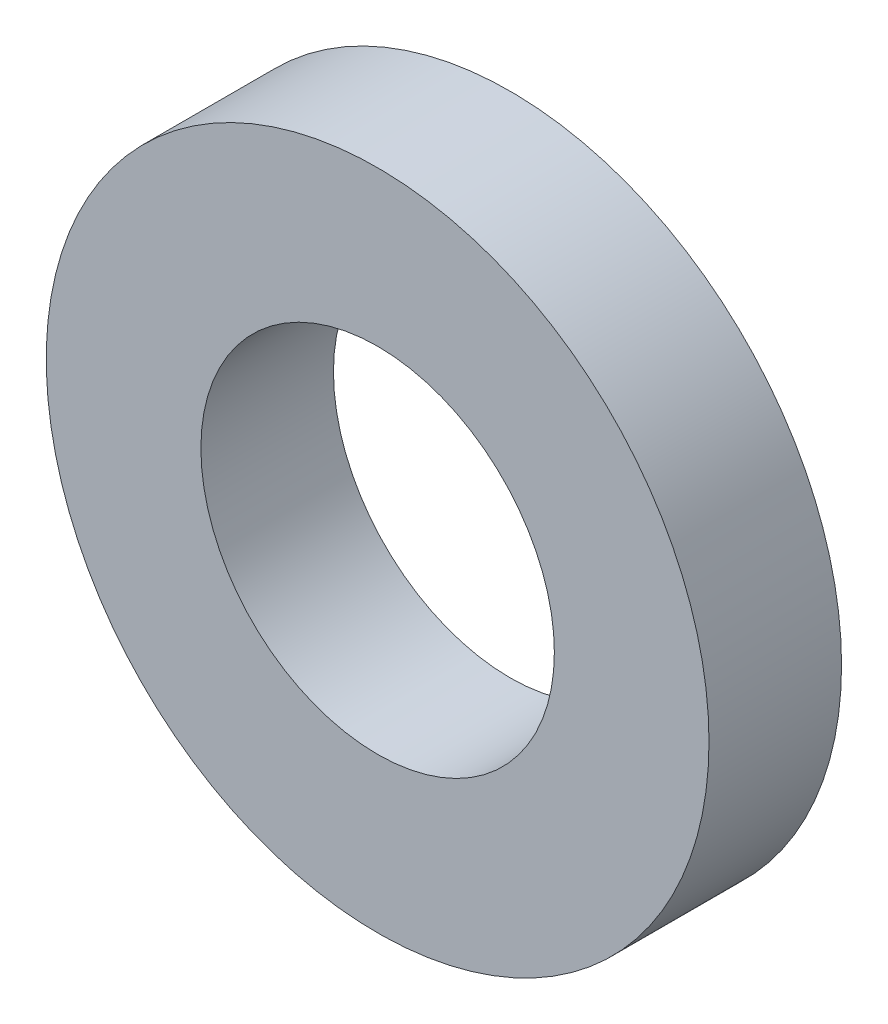
from build123d import *

# Parameters (mm, degrees)
SKETCH1_R           = 7.5
SKETCH1_R_2         = 4
BOSS_EXTRUDE1_DEPTH = 1.5


with BuildPart() as part:
    # Sketch1 → Boss-Extrude1 (new, symmetric)
    with BuildSketch(Plane.XY):
        Circle(SKETCH1_R)
        Circle(SKETCH1_R_2, mode=Mode.SUBTRACT)
    extrude(amount=BOSS_EXTRUDE1_DEPTH, both=True)


solid = part.part
